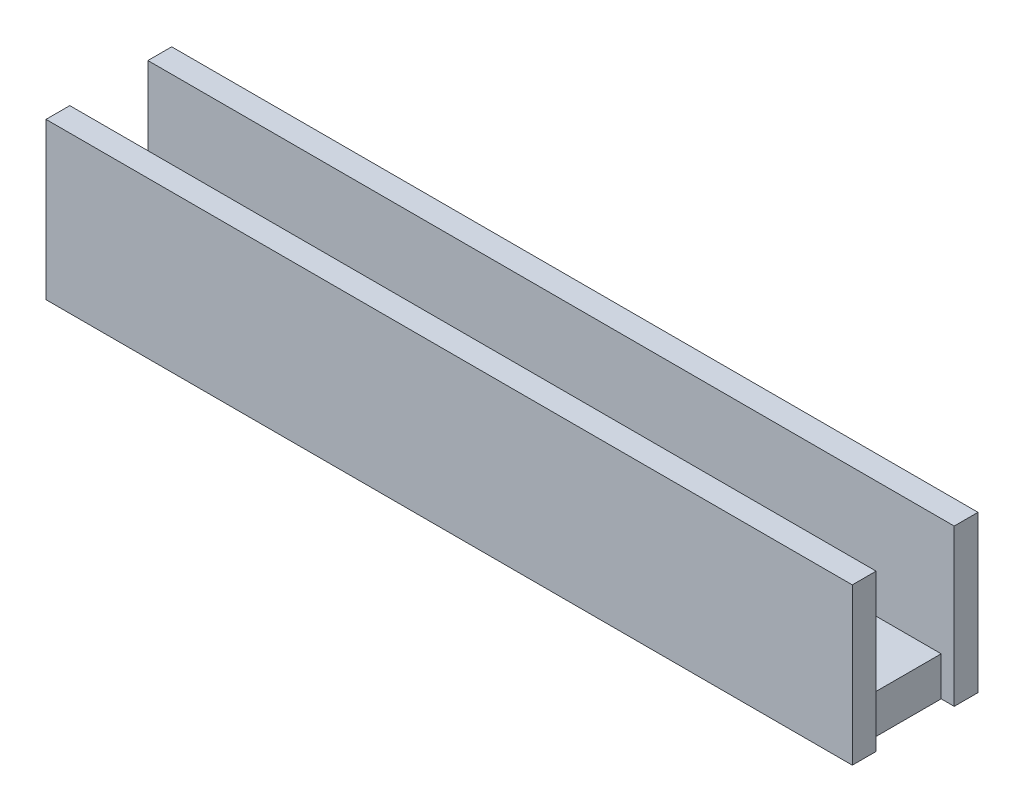
from build123d import *

# Parameters (mm, degrees)
SKETCH1_W             = 50
SKETCH1_H             = 4.999999906
BOSS_EXTRUDE1_DEPTH   = 2.5
SKETCH1_3_W           = 51.6255
SKETCH1_3_H           = 1.524
BOSS_EXTRUDE2_DEPTH   = 10
BOSS_EXTRUDE2_2_DEPTH = 10


with BuildPart() as part:
    # Sketch1 → Boss-Extrude1 (new body)
    with BuildSketch(Plane(origin=(0, 0, 0), x_dir=(1, 0, 0), z_dir=(0, 1, 0))):
        with Locations((25, -2.499999953)):
            Rectangle(SKETCH1_W, SKETCH1_H)
    extrude(amount=BOSS_EXTRUDE1_DEPTH)


with BuildPart() as body_2:
    # Sketch1<3> → Boss-Extrude2 (new body)
    with BuildSketch(Plane(origin=(0, 0, 0), x_dir=(1, 0, 0), z_dir=(0, 1, 0))):
        with Locations((25.020089004, -5.761999906)):
            Rectangle(SKETCH1_3_W, SKETCH1_3_H)
    extrude(amount=BOSS_EXTRUDE2_DEPTH)


with BuildPart() as body_3:
    # Sketch1<3> → Boss-Extrude2 2 (new body)
    with BuildSketch(Plane(origin=(0, 0, 0), x_dir=(1, 0, 0), z_dir=(0, 1, 0))):
        with Locations((25.020089004, 0.762)):
            Rectangle(SKETCH1_3_W, SKETCH1_3_H)
    extrude(amount=BOSS_EXTRUDE2_2_DEPTH)


solid = Compound([part.part, body_2.part, body_3.part])
